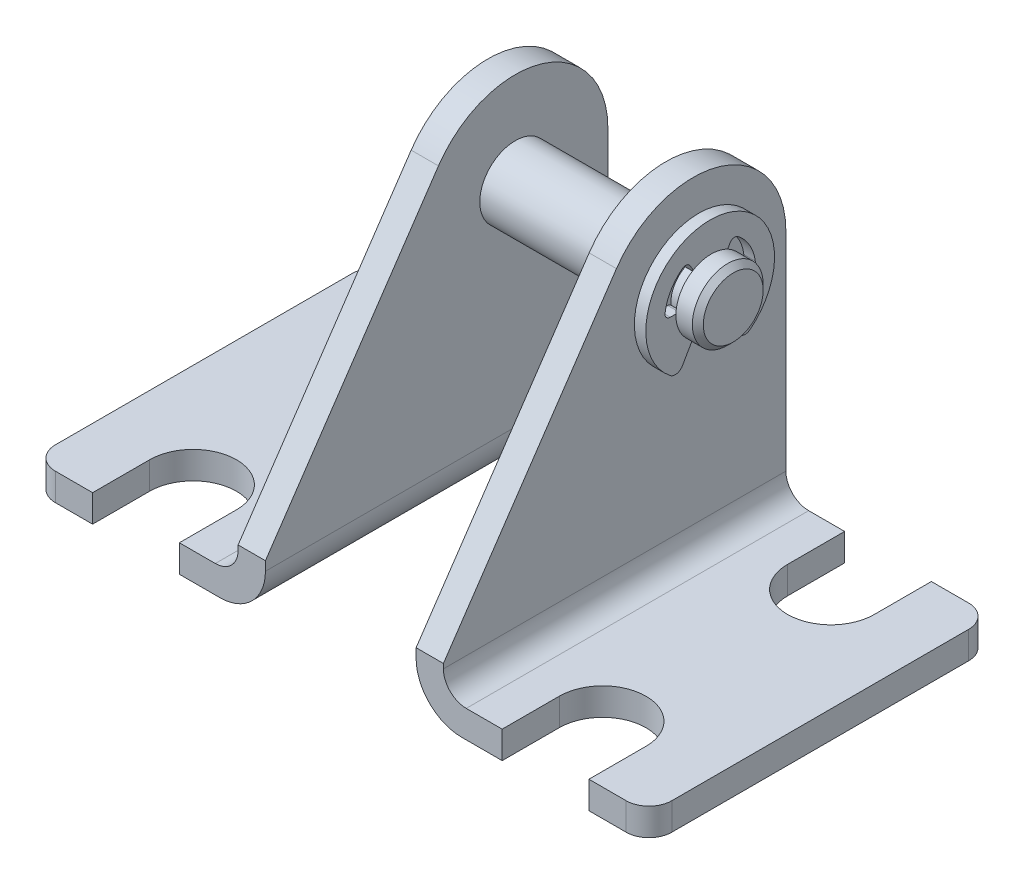
from build123d import *

# Parameters (mm, degrees)
BOSS_EXTRUDE1_DEPTH   = 1.51892
BOSS_EXTRUDE1_2_DEPTH = 1.51892
SKETCH4_R             = 1.96977
BOSS_EXTRUDE2_DEPTH   = 1.51892
SKETCH5_R             = 1.96977
BOSS_EXTRUDE3_DEPTH   = 1.51892
FILLET1_R             = 1.27
FILLET2_R             = 2.54
FILLET3_R             = 1.27
FILLET4_R             = 2.54
BOSS_EXTRUDE5_DEPTH   = 0.3175


with BuildPart() as part:
    # Sketch3 → Boss-Extrude1 (new body)
    with BuildSketch(Plane(origin=(0, 0, 0), x_dir=(1, 0, 0), z_dir=(0, 1, 0))):
        with BuildLine():
            Line((8.9789, -13.8938), (8.9789, -10.7188))
            ThreePointArc((8.9789, -10.7188), (11.3919, -8.3058), (13.8049, -10.7188))
            Line((13.8049, -10.7188), (13.8049, -13.8938))
            Line((13.8049, -13.8938), (17.145, -13.8938))
            Line((17.145, -13.8938), (17.145, 5.1562))
            Line((17.145, 5.1562), (13.8049, 5.1562))
            Line((13.8049, 5.1562), (13.8049, 1.9812))
            ThreePointArc((13.8049, 1.9812), (11.3919, -0.4318), (8.9789, 1.9812))
            Line((8.9789, 1.9812), (8.9789, 5.1562))
            Line((8.9789, 5.1562), (4.191, 5.1562))
            Line((4.191, 5.1562), (4.191, -13.8938))
            Line((4.191, -13.8938), (8.9789, -13.8938))
        make_face()
    extrude(amount=BOSS_EXTRUDE1_DEPTH)

    # Sketch5 → Boss-Extrude3 (add)
    with BuildSketch(Plane.ZY.offset(-4.191)):
        with BuildLine():
            Line((-5.1562, 0), (13.8938, 0))
            Line((13.8938, 0), (13.8938, 3.048))
            Line((13.8938, 3.048), (4.268855818, 17.255631611))
            ThreePointArc((4.268855818, 17.255631611), (-1.512501912, 19.293074849), (-5.1562, 14.3637))
            Line((-5.1562, 14.3637), (-5.1562, 0))
        make_face()
        with Locations(Location((0, 14.3637, 0), (0, 0, 180))):
            Circle(SKETCH5_R, mode=Mode.SUBTRACT)
    extrude(amount=-BOSS_EXTRUDE3_DEPTH)

    # Fillet3
    fillet3_edges = [part.edges().sort_by_distance(p)[0] for p in [
        (17.145, 0.75946, -5.1562),
        (17.145, 0.75946, 13.8938),
        (5.70992, 1.51892, 4.3688),
    ]]
    fillet(fillet3_edges, radius=FILLET3_R)

    # Fillet4
    fillet4_edges = [part.edges().sort_by_distance(p)[0] for p in [
        (4.191, 0, 4.3688),
    ]]
    fillet(fillet4_edges, radius=FILLET4_R)


with BuildPart() as body_2:
    # Sketch3 → Boss-Extrude1 2 (new body)
    with BuildSketch(Plane(origin=(0, 0, 0), x_dir=(1, 0, 0), z_dir=(0, 1, 0))):
        with BuildLine():
            Line((-17.145, -13.8938), (-13.8049, -13.8938))
            Line((-13.8049, -13.8938), (-13.8049, -10.7188))
            ThreePointArc((-13.8049, -10.7188), (-11.3919, -8.3058), (-8.9789, -10.7188))
            Line((-8.9789, -10.7188), (-8.9789, -13.8938))
            Line((-8.9789, -13.8938), (-4.191, -13.8938))
            Line((-4.191, -13.8938), (-4.191, 5.1562))
            Line((-4.191, 5.1562), (-8.9789, 5.1562))
            Line((-8.9789, 5.1562), (-8.9789, 1.9812))
            ThreePointArc((-8.9789, 1.9812), (-11.3919, -0.4318), (-13.8049, 1.9812))
            Line((-13.8049, 1.9812), (-13.8049, 5.1562))
            Line((-13.8049, 5.1562), (-17.145, 5.1562))
            Line((-17.145, 5.1562), (-17.145, -13.8938))
        make_face()
    extrude(amount=BOSS_EXTRUDE1_2_DEPTH)

    # Sketch4 → Boss-Extrude2 (add)
    with BuildSketch(Plane(origin=(-4.191, 0, 0), x_dir=(0, 0, -1), z_dir=(1, 0, 0))):
        with BuildLine():
            Line((-13.8938, 0), (5.1562, 0))
            Line((5.1562, 0), (5.1562, 14.3637))
            ThreePointArc((5.1562, 14.3637), (1.512501912, 19.293074849), (-4.268855818, 17.255631611))
            Line((-4.268855818, 17.255631611), (-13.8938, 3.048))
            Line((-13.8938, 3.048), (-13.8938, 0))
        make_face()
        with Locations((0, 14.3637)):
            Circle(SKETCH4_R, mode=Mode.SUBTRACT)
    extrude(amount=-BOSS_EXTRUDE2_DEPTH)

    # Fillet1
    fillet1_edges = [body_2.edges().sort_by_distance(p)[0] for p in [
        (-17.145, 0.75946, -5.1562),
        (-17.145, 0.75946, 13.8938),
        (-5.70992, 1.51892, 4.3688),
    ]]
    fillet(fillet1_edges, radius=FILLET1_R)

    # Fillet2
    fillet2_edges = [body_2.edges().sort_by_distance(p)[0] for p in [
        (-4.191, 0, 4.3688),
    ]]
    fillet(fillet2_edges, radius=FILLET2_R)


with BuildPart() as body_3:
    # Sketch6 → Revolve1 (revolve)
    with BuildSketch(Plane.XY, mode=Mode.PRIVATE) as revolve1_sk:
        Polygon((-7.6327, 16.33347), (-6.7183, 16.33347), (-6.7183, 15.8496), (-5.9563, 15.8496), (-5.9563, 16.33347), (5.9563, 16.33347), (5.9563, 15.8496), (6.7183, 15.8496), (6.7183, 16.33347), (7.6327, 16.33347), (7.9375, 16.02867), (7.9375, 14.3637), (-7.9375, 14.3637), (-7.9375, 16.02867), align=None)
    revolve(revolve1_sk.sketch.rotate(Axis((-7.9375, 14.3637, 0), (1, 0, 0)), 90), axis=Axis((-7.9375, 14.3637, 0), (1, 0, 0)))


with BuildPart() as body_4:
    # Sketch7 → Boss-Extrude5 (new, symmetric)
    with BuildSketch(Plane(origin=(-6.3373, 0, 0), x_dir=(0, 0, -1), z_dir=(1, 0, 0))):
        with BuildLine():
            Line((0.863707967, 15.859686081), (1.107592732, 16.282106885))
            ThreePointArc((1.107592732, 16.282106885), (1.308275812, 16.425684925), (1.548457805, 16.369107876))
            ThreePointArc((1.548457805, 16.369107876), (2.194205264, 15.630525), (2.510963068, 14.701999858))
            ThreePointArc((2.510963068, 14.701999858), (2.439869233, 14.465707626), (2.215185463, 14.3637))
            Line((2.215185463, 14.3637), (1.727415933, 14.3637))
            ThreePointArc((1.727415933, 14.3637), (1.557118721, 14.300533313), (1.4692061, 14.141591368))
            ThreePointArc((1.4692061, 14.141591368), (1.286827147, 13.62075), (0.926954768, 13.20238451))
            ThreePointArc((0.926954768, 13.20238451), (0.833263316, 13.046778975), (0.863707967, 12.867713919))
            Line((0.863707967, 12.867713919), (1.550791691, 11.67765))
            ThreePointArc((1.550791691, 11.67765), (1.85388699, 11.461879377), (2.215416701, 11.549742857))
            ThreePointArc((2.215416701, 11.549742857), (0, 17.9451), (-2.215416701, 11.549742857))
            ThreePointArc((-2.215416701, 11.549742857), (-1.85388699, 11.461879377), (-1.550791691, 11.67765))
            Line((-1.550791691, 11.67765), (-0.863707967, 12.867713919))
            ThreePointArc((-0.863707967, 12.867713919), (-0.833263316, 13.046778975), (-0.926954768, 13.20238451))
            ThreePointArc((-0.926954768, 13.20238451), (-1.286827147, 13.62075), (-1.4692061, 14.141591368))
            ThreePointArc((-1.4692061, 14.141591368), (-1.557118721, 14.300533313), (-1.727415933, 14.3637))
            Line((-1.727415933, 14.3637), (-2.215185463, 14.3637))
            ThreePointArc((-2.215185463, 14.3637), (-2.439869233, 14.465707626), (-2.510963068, 14.701999858))
            ThreePointArc((-2.510963068, 14.701999858), (-2.194205264, 15.630525), (-1.548457805, 16.369107876))
            ThreePointArc((-1.548457805, 16.369107876), (-1.308275812, 16.425684925), (-1.107592732, 16.282106885))
            Line((-1.107592732, 16.282106885), (-0.863707967, 15.859686081))
            ThreePointArc((-0.863707967, 15.859686081), (-0.723855405, 15.743787712), (-0.542251332, 15.747124123))
            ThreePointArc((-0.542251332, 15.747124123), (0, 15.8496), (0.542251332, 15.747124123))
            ThreePointArc((0.542251332, 15.747124123), (0.723855405, 15.743787712), (0.863707967, 15.859686081))
        make_face()
    extrude(amount=BOSS_EXTRUDE5_DEPTH, both=True)


with BuildPart() as body_5:
    # Mirror1: mirrored copy
    add(body_4.part.mirror(Plane(origin=(0, 0, 0), x_dir=(0, 0, 1), z_dir=(1, 0, 0))))


solid = Compound([part.part, body_2.part, body_3.part, body_4.part, body_5.part])
